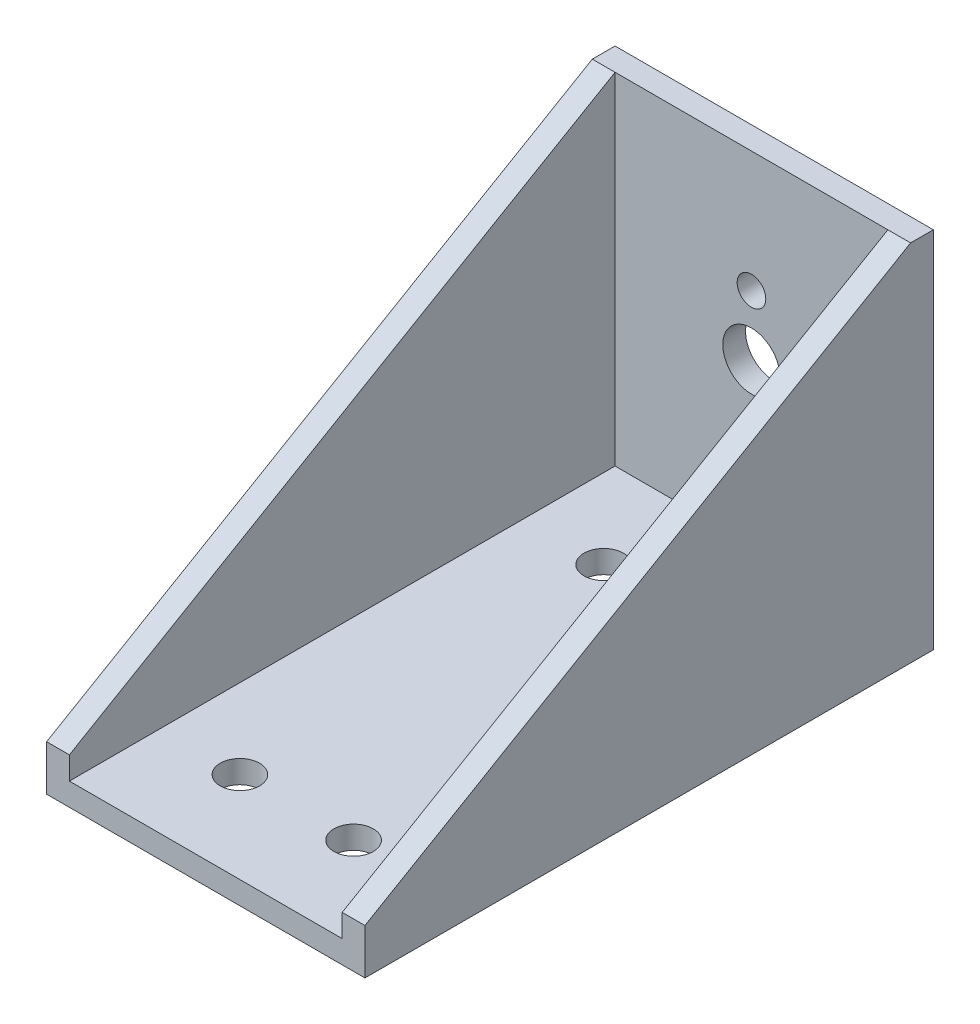
from build123d import *

# Parameters (mm, degrees)
SKETCH1_W           = 44.45
SKETCH1_H           = 50.8
SKETCH1_R           = 2
SKETCH1_R_2         = 4
BOSS_EXTRUDE1_DEPTH = 3.175
SKETCH3_W           = 44.45
SKETCH3_H           = 3.175
BOSS_EXTRUDE2_DEPTH = 76.2
SKETCH6_W           = 3.175
SKETCH6_H           = 76.2
BOSS_EXTRUDE3_DEPTH = 47.625
CHAMFER1_SIZE       = 44.45
CHAMFER1_SIZE2      = 76.2
SKETCH8_R           = 2.75
CUT_EXTRUDE1_DEPTH  = 96.197068626


with BuildPart() as part:
    # Sketch1 → Boss-Extrude1 (new body)
    with BuildSketch(Plane.XY):
        Rectangle(SKETCH1_W, SKETCH1_H)
        with Locations((0, 8.5)):
            Circle(SKETCH1_R, mode=Mode.SUBTRACT)
        with Locations(Location((0, -8.5, 0), (0, 0, 180))):
            Circle(SKETCH1_R, mode=Mode.SUBTRACT)
        Circle(SKETCH1_R_2, mode=Mode.SUBTRACT)
    extrude(amount=BOSS_EXTRUDE1_DEPTH)

    # Sketch3 → Boss-Extrude2 (add)
    with BuildSketch(Plane.XY.offset(3.175)):
        with Locations((0, -23.8125)):
            Rectangle(SKETCH3_W, SKETCH3_H)
    extrude(amount=BOSS_EXTRUDE2_DEPTH)

    # Sketch6 → Boss-Extrude3 (add)
    with BuildSketch(Plane(origin=(0, -22.225, 0), x_dir=(1, 0, 0), z_dir=(0, 1, 0))):
        with Locations((20.6375, -41.275)):
            Rectangle(SKETCH6_W, SKETCH6_H)
        with Locations((-20.6375, -41.275)):
            Rectangle(SKETCH6_W, SKETCH6_H)
    extrude(amount=BOSS_EXTRUDE3_DEPTH)

    # Chamfer1
    chamfer1_edges = [part.edges().sort_by_distance(p)[0] for p in [
        (-20.6375, 25.4, 79.375),
        (20.6375, 25.4, 79.375),
    ]]
    chamfer1_side = [part.faces().sort_by_distance(p)[0] for p in [
        (0, -24.724985741, 79.375),
    ]]
    chamfer(chamfer1_edges, length=CHAMFER1_SIZE, length2=CHAMFER1_SIZE2, reference=chamfer1_side[0])

    # Sketch8 → Cut-Extrude1 (cut, through all)
    with BuildSketch(Plane(origin=(0, -22.225, 0), x_dir=(1, 0, 0), z_dir=(0, 1, 0))):
        with Locations(Location((-7.9375, -15.875, 0), (0, 0, 270))):
            Circle(SKETCH8_R)
        with Locations(Location((7.9375, -15.875, 0), (0, 0, 270))):
            Circle(SKETCH8_R)
        with Locations(Location((7.9375, -66.675, 0), (0, 0, 270))):
            Circle(SKETCH8_R)
        with Locations(Location((-7.9375, -66.675, 0), (0, 0, 270))):
            Circle(SKETCH8_R)
    extrude(amount=-CUT_EXTRUDE1_DEPTH, mode=Mode.SUBTRACT)


solid = part.part
